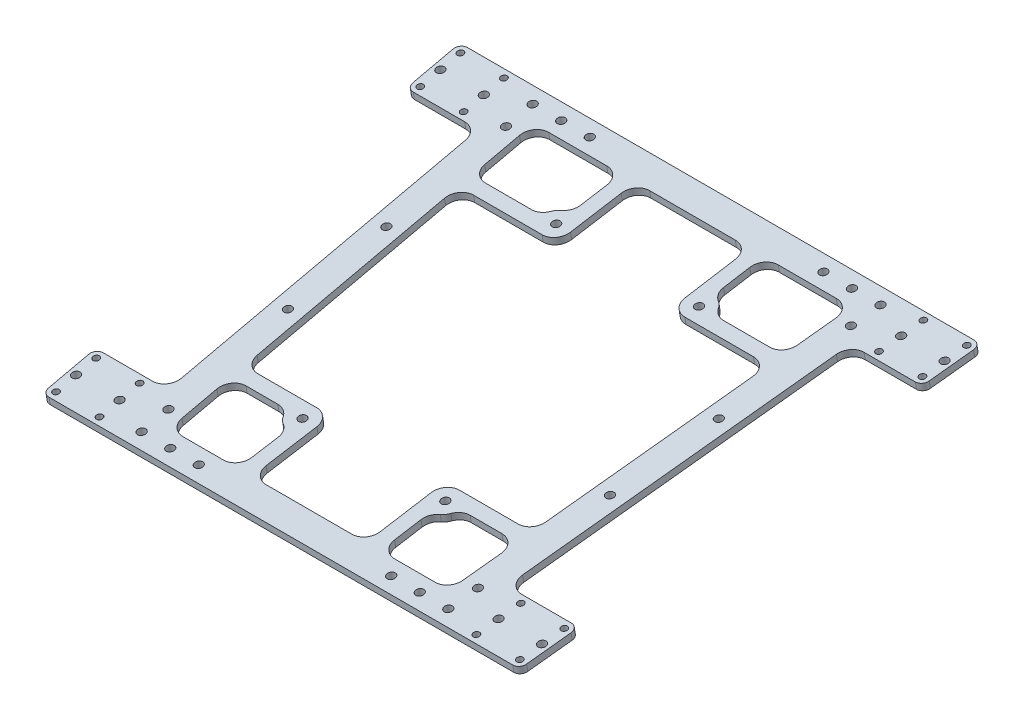
from build123d import *

# Parameters (mm, degrees)
BOSS_EXTRUDE1_START                            = 19.177
BOSS_EXTRUDE1_DEPTH                            = 6.35
THE_START                                      = 19.177
THE_PARENT_OF_THIS_SKETCH_FEATURE_IS_TEC_DEPTH = 6.35
F_1_4_CLEARANCE_HOLE1_D                        = 7.14248
F_10_CLEARANCE_HOLE1_D                         = 5.6134
F_1_4_CLEARANCE_HOLE2_D                        = 7.14248
F_1_4_CLEARANCE_HOLE3_D                        = 7.14248
F_1_4_CLEARANCE_HOLE3_DEPTH                    = 69.85
F_1_4_CLEARANCE_HOLE3_TIP                      = 2.145817477
LPATTERN1_COUNT                                = 2
LPATTERN1_PITCH                                = 345.956759444
FILLET1_R                                      = 12.7
CUT_EXTRUDE1_DEPTH                             = 1274.89213388
CUT_EXTRUDE1_DEPTH_BACK                        = 1274.89213388
FILLET2_R                                      = 12.7


with BuildPart() as part:
    # Sketch1 → Boss-Extrude1 (new body)
    with BuildSketch(Plane(origin=(0, 638.273366266, 104.898636105), x_dir=(1, 0, 0), z_dir=(0, 0.9867625124381897, 0.16217195826243153)).offset(BOSS_EXTRUDE1_START)):
        with BuildLine():
            ThreePointArc((206.231923605, -1251.647457675), (210.610021389, -1249.896888052), (212.574208941, -1245.610374146))
            Line((212.574208941, -1245.610374146), (214.453991527, -1207.510374146))
            ThreePointArc((214.453991527, -1207.510374146), (212.711136569, -1202.819359891), (208.111706191, -1200.847457675))
            Line((208.111706191, -1200.847457675), (150.961480682, -1200.847457675))
            Line((150.961480682, -1200.847457675), (165.503224874, -906.11100369))
            Line((165.503224874, -906.11100369), (223.280044579, -906.11100369))
            ThreePointArc((223.280044579, -906.11100369), (227.658142363, -904.360434067), (229.622329915, -900.073920161))
            Line((229.622329915, -900.073920161), (231.502112501, -861.97392016))
            ThreePointArc((231.502112501, -861.97392016), (229.759257542, -857.282905906), (225.159827165, -855.31100369))
            Line((225.159827165, -855.31100369), (0, -855.31100369))
            Line((0, -855.31100369), (0, -880.71100369))
            Line((0, -880.71100369), (141.325517073, -880.71100369))
            Line((141.325517073, -880.71100369), (124.277396099, -1226.247457675))
            Line((124.277396099, -1226.247457675), (0, -1226.247457675))
            Line((0, -1226.247457675), (0, -1251.647457675))
            Line((0, -1251.647457675), (206.231923605, -1251.647457675))
        make_face()
    extrude(amount=BOSS_EXTRUDE1_DEPTH)

    # Sketch2 → the parent of this sketch feature is tec (add)
    with BuildSketch(Plane(origin=(0, 638.273366266, 104.898636105), x_dir=(1, 0, 0), z_dir=(0, 0.9867625124381899, 0.1621719582624301)).offset(THE_START)):
        with BuildLine():
            Line((63.5, -1155.079230682), (127.788703023, -1155.079230682))
            Line((127.788703023, -1155.079230682), (124.277396099, -1226.247457675))
            Line((124.277396099, -1226.247457675), (50.8, -1226.247457675))
            Line((50.8, -1226.247457675), (50.8, -1167.779230682))
            ThreePointArc((50.8, -1167.779230682), (54.519743879, -1158.798974561), (63.5, -1155.079230682))
        make_face()
        with BuildLine():
            Line((50.8, -939.179230682), (50.8, -880.71100369))
            Line((50.8, -880.71100369), (141.325517073, -880.71100369))
            Line((141.325517073, -880.71100369), (137.814210149, -951.879230683))
            Line((137.814210149, -951.879230683), (63.5, -951.879230683))
            ThreePointArc((63.5, -951.879230683), (54.519743879, -948.159486804), (50.8, -939.179230682))
        make_face()
    extrude(amount=THE_PARENT_OF_THIS_SKETCH_FEATURE_IS_TEC_DEPTH)

    # 1/4 Clearance Hole1 (through all)
    with Locations(Plane(origin=(0, 663.462452921, 109.038399683), x_dir=(1, 0, 0), z_dir=(0, 0.9867625124381897, 0.16217195826243158))):
        with Locations((63.5, -1167.779230682), (63.5, -939.179230682)):
            Hole(F_1_4_CLEARANCE_HOLE1_D / 2)

    # #10 Clearance Hole1 (through all)
    with Locations(Plane(origin=(0, 663.462452921, 109.038399683), x_dir=(1, 0, 0), z_dir=(0, 0.9867625124381897, 0.16217195826243141))):
        with Locations((167.576961393, -1245.297457675), (169.456743979, -1207.197457675), (208.111706191, -1207.197457675), (206.231923605, -1245.297457675)):
            f_10_clearance_hole1 = Hole(F_10_CLEARANCE_HOLE1_D / 2)

    # 1/4 Clearance Hole2 (through all)
    with Locations(Plane(origin=(0, 663.462452921, 109.038399683), x_dir=(1, 0, 0), z_dir=(0, 0.9867625124381897, 0.16217195826243141))):
        with Locations((207.171814898, -1226.247457675), (168.516852686, -1226.247457675)):
            f_1_4_clearance_hole2 = Hole(F_1_4_CLEARANCE_HOLE2_D / 2)

    # 1/4 Clearance Hole3
    with Locations(Plane(origin=(0, 663.462452921, 109.038399683), x_dir=(1, 0, 0), z_dir=(0, 0.9867625124381896, 0.1621719582624316))):
        with Locations((110.96625, -1238.947457675), (85.56625, -1238.947457675), (136.36625, -1238.947457675), (137.617915883, -1213.578316331), (103.867559364, -868.01100369), (129.267559364, -868.01100369), (154.667559364, -868.01100369), (153.415893482, -893.380145034), (143.213213625, -1100.171135326), (147.820595739, -1006.787326039)):
            Hole(F_1_4_CLEARANCE_HOLE3_D / 2, depth=F_1_4_CLEARANCE_HOLE3_DEPTH)
            with Locations((0, 0, -(F_1_4_CLEARANCE_HOLE3_DEPTH + F_1_4_CLEARANCE_HOLE3_TIP / 2))):  # 118° drill point
                Cone(0, F_1_4_CLEARANCE_HOLE3_D / 2, F_1_4_CLEARANCE_HOLE3_TIP, mode=Mode.SUBTRACT)

    # LPattern1: #10 Clearance Hole1, 1/4 Clearance Hole2 ×2
    with Locations(*[Vector(0.04927818435185996, 0.1619749342972518, -0.9855636870372128) * (i * LPATTERN1_PITCH) for i in range(1, LPATTERN1_COUNT)]):
        add(f_10_clearance_hole1, mode=Mode.SUBTRACT)
        add(f_1_4_clearance_hole2, mode=Mode.SUBTRACT)

    # Fillet1
    fillet1_edges = [part.edges().sort_by_distance(p)[0] for p in [
        (165.503224874, 513.383686072, 1002.639874265),
        (150.961480682, 465.585698158, 1293.474758106),
        (127.788703023, 473.008021156, 1248.312387449),
        (50.8, 461.466530418, 1318.538525922),
        (50.8, 517.502853812, 977.576106449),
        (137.814210149, 505.961363075, 1047.802244922),
    ]]
    fillet(fillet1_edges, radius=FILLET1_R)

    # Sketch11 → Cut-Extrude1 (cut, two sides: drawn at the far end of the back side and taken through both)
    with BuildSketch(Plane(origin=(0, 663.462452921, 109.038399683), x_dir=(1, 0, 0), z_dir=(0, 0.9867625124381896, 0.1621719582624316)).offset(-CUT_EXTRUDE1_DEPTH_BACK)):
        with BuildLine():
            Line((124.277396099, -1226.247457675), (127.162108828, -1167.779230682))
            Line((127.162108828, -1167.779230682), (76.2, -1167.779230682))
            ThreePointArc((76.2, -1167.779230682), (72.480256121, -1176.759486803), (63.5, -1180.479230682))
            Line((63.5, -1180.479230682), (63.5, -1226.247457675))
            Line((63.5, -1226.247457675), (124.277396099, -1226.247457675))
        make_face()
        with BuildLine():
            Line((138.440804345, -939.179230683), (141.325517073, -880.71100369))
            Line((141.325517073, -880.71100369), (63.5, -880.71100369))
            Line((63.5, -880.71100369), (63.5, -926.479230682))
            ThreePointArc((63.5, -926.479230682), (72.480256121, -930.198974561), (76.2, -939.179230682))
            Line((76.2, -939.179230683), (138.440804345, -939.179230683))
        make_face()
    extrude(amount=CUT_EXTRUDE1_DEPTH + CUT_EXTRUDE1_DEPTH_BACK, mode=Mode.SUBTRACT)

    # Fillet2
    fillet2_edges = [part.edges().sort_by_distance(p)[0] for p in [
        (63.5, 468.888853416, 1273.376155265),
        (76.2, 470.948437286, 1260.844271357),
        (127.162108828, 470.948437286, 1260.844271357),
        (124.277396099, 461.466530418, 1318.538525922),
        (63.5, 461.466530418, 1318.538525922),
        (76.2, 508.020946945, 1035.270361014),
        (63.5, 510.080530815, 1022.738477106),
        (63.5, 517.502853812, 977.576106449),
        (141.325517073, 517.502853812, 977.576106449),
        (138.440804345, 508.020946945, 1035.270361014),
    ]]
    fillet(fillet2_edges, radius=FILLET2_R)

    # Mirror1: part across plane


with BuildPart() as part_1:
    add(part.part)
    add(part.part.mirror(Plane(origin=(0, 0, 0), x_dir=(0, 0, 1), z_dir=(1, 0, 0))))


solid = part_1.part
